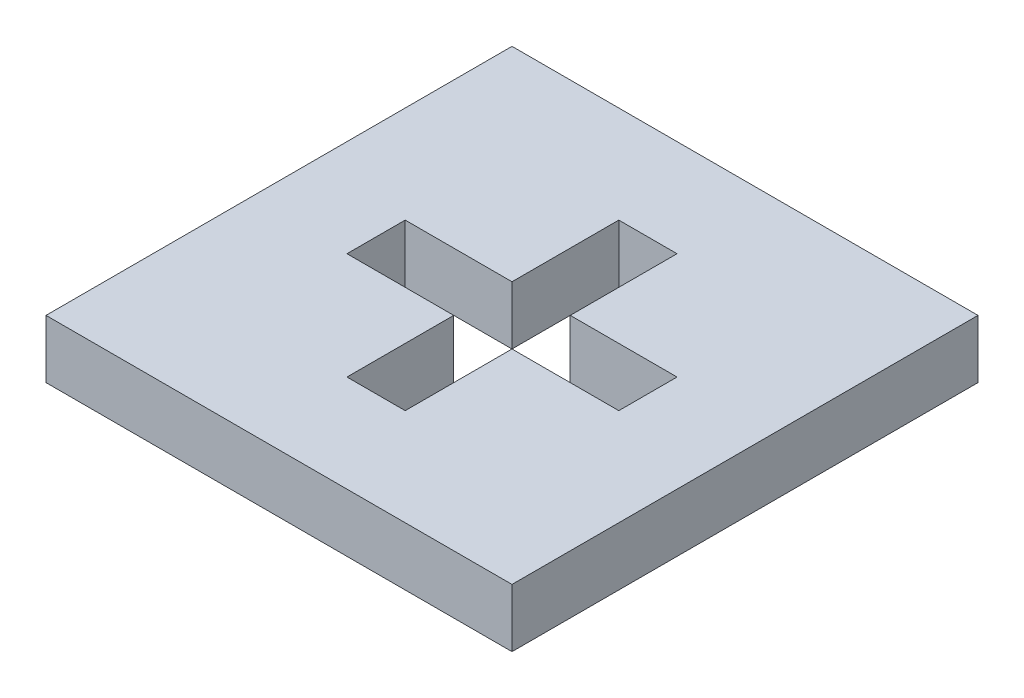
from build123d import *

# Parameters (mm, degrees)
SKETCH1_W           = 50.8
SKETCH1_H           = 50.8
BOSS_EXTRUDE1_DEPTH = 6.35
CUT_EXTRUDE1_DEPTH  = 6.35


with BuildPart() as part:
    # Sketch1 → Boss-Extrude1 (new body)
    with BuildSketch(Plane(origin=(0, 0, 0), x_dir=(1, 0, 0), z_dir=(0, 1, 0))):
        with Locations((25.4, 25.4)):
            Rectangle(SKETCH1_W, SKETCH1_H)
    extrude(amount=BOSS_EXTRUDE1_DEPTH)

    # Sketch2 → Cut-Extrude1 (cut)
    with BuildSketch(Plane(origin=(0, 6.35, 0), x_dir=(1, 0, 0), z_dir=(0, 1, 0))):
        Polygon((28.575, 28.575), (40.216666667, 28.575), (40.216666667, 22.225), (28.575, 22.225), (28.575, 10.583333333), (22.225, 10.583333333), (22.225, 22.225), (10.583333333, 22.225), (10.583333333, 28.575), (22.225, 28.575), (22.225, 40.216666667), (28.575, 40.216666667), align=None)
    extrude(amount=-CUT_EXTRUDE1_DEPTH, mode=Mode.SUBTRACT)


solid = part.part
